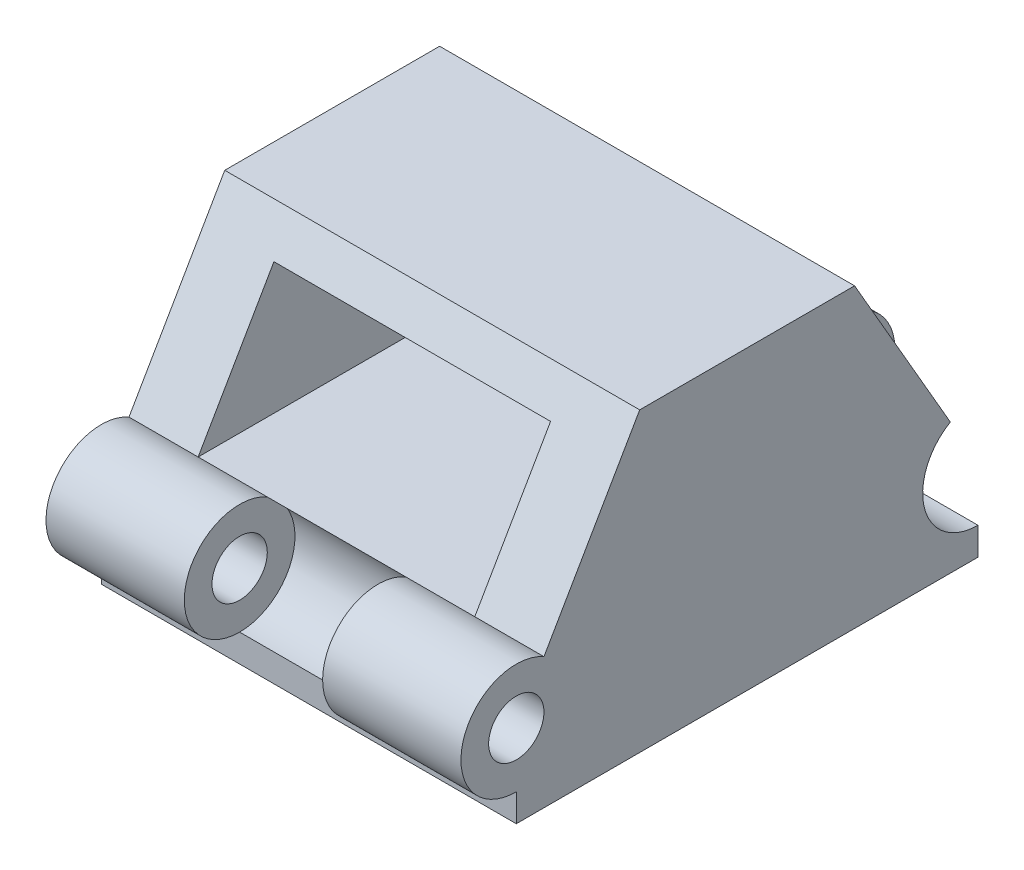
from build123d import *

# Parameters (mm, degrees)
EXTRUDE_1_DEPTH      = 30
SKETCH_2_W           = 20
SKETCH_2_H           = 10.454482672
CUT_EXTRUDE_1_DEPTH  = 52.134626233
CUT_EXTRUDE_4_DEPTH  = 52.134626233
SKETCH_4_R           = 4
SKETCH_4_R_2         = 2
EXTRUDE_2_DEPTH      = 30
CUT_EXTRUDE_5_DEPTH  = 53.403183519
SKETCH_6_R           = 4
SKETCH_6_R_2         = 2
EXTRUDE_3_DEPTH      = 30
CUT_EXTRUDE_START    = -10
SKETCH_7_R           = 4
SKETCH_7_R_2         = 2
CUT_EXTRUDE_8_DEPTH  = 10
SKETCH_8_R           = 4
SKETCH_8_R_2         = 2
CUT_EXTRUDE_9_DEPTH  = 10
CUT_EXTRUDE_START_2  = -20
SKETCH_9_R           = 4
SKETCH_9_R_2         = 2
CUT_EXTRUDE_10_DEPTH = 10
EXTRUDE_4_DEPTH      = 30
SKETCH_12_W          = 33.381197846
SKETCH_12_H          = 2
EXTRUDE_5_DEPTH      = 30
EXTRUDE_6_DEPTH      = 30
SKETCH_13_W          = 20
SKETCH_13_H          = 3.5
CUT_EXTRUDE_11_DEPTH = 30


with BuildPart() as part:
    # 스케치1 → 보스-돌출1 (new body)
    with BuildSketch(Plane(origin=(0, 0, 0), x_dir=(0, 0, -1), z_dir=(1, 0, 0))):
        Polygon((0, 0), (9.5, 16.454482672), (28.5, 16.454482672), (38, 0), align=None)
    extrude(amount=EXTRUDE_1_DEPTH)

    # 스케치2 → 컷-돌출1 (cut, through all)
    with BuildSketch(Plane.XY):
        with Locations((15, 8.227241336)):
            Rectangle(SKETCH_2_W, SKETCH_2_H)
    extrude(amount=-CUT_EXTRUDE_1_DEPTH, mode=Mode.SUBTRACT)

    # 스케치3 → 컷-돌출4 (cut, through all)
    with BuildSketch(Plane(origin=(30, 0, 0), x_dir=(0, 0, -1), z_dir=(1, 0, 0))):
        with BuildLine():
            Line((33.690598923, 7.464101615), (37.690598923, 0.535898385))
            ThreePointArc((37.690598923, 0.535898385), (39.154700538, 2), (39.690598923, 4))
            ThreePointArc((39.690598923, 4), (37.690598923, 7.464101615), (33.690598923, 7.464101615))
        make_face()
        with BuildLine():
            ThreePointArc((35.690598923, 0), (36.725875104, 0.136296695), (37.690598923, 0.535898385))
            Line((37.690598923, 0.535898385), (33.690598923, 7.464101615))
            ThreePointArc((33.690598923, 7.464101615), (31.826895618, 2.96472382), (35.690598923, 0))
        make_face()
        with BuildLine():
            Line((35.690598923, 0), (38, 0))
            Line((38, 0), (37.690598923, 0.535898385))
            ThreePointArc((37.690598923, 0.535898385), (36.725875104, 0.136296695), (35.690598923, 0))
        make_face()
    extrude(amount=-CUT_EXTRUDE_4_DEPTH, mode=Mode.SUBTRACT)

    # 스케치4 → 보스-돌출2 (add)
    with BuildSketch(Plane(origin=(30, 0, 0), x_dir=(0, 0, -1), z_dir=(1, 0, 0))):
        with Locations((35.690598923, 4)):
            Circle(SKETCH_4_R)
        with Locations((35.690598923, 4)):
            Circle(SKETCH_4_R_2, mode=Mode.SUBTRACT)
    extrude(amount=-EXTRUDE_2_DEPTH)

    # 스케치5 → 컷-돌출5 (cut, through all)
    with BuildSketch(Plane(origin=(30, 0, 0), x_dir=(0, 0, -1), z_dir=(1, 0, 0))):
        with BuildLine():
            Line((4.309401077, 7.464101615), (0.309401077, 0.535898385))
            ThreePointArc((0.309401077, 0.535898385), (1.274124896, 0.136296695), (2.309401077, 0))
            ThreePointArc((2.309401077, 0), (5.137828202, 1.171572875), (6.309401077, 4))
            ThreePointArc((6.309401077, 4), (5.773502692, 6), (4.309401077, 7.464101615))
        make_face()
        with BuildLine():
            ThreePointArc((4.309401077, 7.464101615), (-1.154700538, 6), (0.309401077, 0.535898385))
            Line((0.309401077, 0.535898385), (4.309401077, 7.464101615))
        make_face()
        with BuildLine():
            ThreePointArc((2.309401077, 0), (1.274124896, 0.136296695), (0.309401077, 0.535898385))
            Line((0.309401077, 0.535898385), (0, 0))
            Line((0, 0), (2.309401077, 0))
        make_face()
    extrude(amount=-CUT_EXTRUDE_5_DEPTH, mode=Mode.SUBTRACT)

    # 스케치6 → 보스-돌출3 (add)
    with BuildSketch(Plane(origin=(30, 0, 0), x_dir=(0, 0, -1), z_dir=(1, 0, 0))):
        with Locations((2.309401077, 4)):
            Circle(SKETCH_6_R)
        with Locations((2.309401077, 4)):
            Circle(SKETCH_6_R_2, mode=Mode.SUBTRACT)
    extrude(amount=-EXTRUDE_3_DEPTH)

    # 스케치7 → 컷-돌출8 (cut)
    with BuildSketch(Plane(origin=(30, 0, 0), x_dir=(0, 0, -1), z_dir=(1, 0, 0)).offset(CUT_EXTRUDE_START)):
        with Locations((2.309401077, 4)):
            Circle(SKETCH_7_R)
        with Locations((2.309401077, 4)):
            Circle(SKETCH_7_R_2, mode=Mode.SUBTRACT)
    extrude(amount=-CUT_EXTRUDE_8_DEPTH, mode=Mode.SUBTRACT)

    # 스케치8 → 컷-돌출9 (cut)
    with BuildSketch(Plane(origin=(30, 0, 0), x_dir=(0, 0, -1), z_dir=(1, 0, 0))):
        with Locations((35.690598923, 4)):
            Circle(SKETCH_8_R)
        with Locations((35.690598923, 4)):
            Circle(SKETCH_8_R_2, mode=Mode.SUBTRACT)
    extrude(amount=-CUT_EXTRUDE_9_DEPTH, mode=Mode.SUBTRACT)

    # 스케치9 → 컷-돌출10 (cut)
    with BuildSketch(Plane(origin=(30, 0, 0), x_dir=(0, 0, -1), z_dir=(1, 0, 0)).offset(CUT_EXTRUDE_START_2)):
        with Locations((35.690598923, 4)):
            Circle(SKETCH_9_R)
        with Locations((35.690598923, 4)):
            Circle(SKETCH_9_R_2, mode=Mode.SUBTRACT)
    extrude(amount=-CUT_EXTRUDE_10_DEPTH, mode=Mode.SUBTRACT)

    # 스케치11 → 보스-돌출4 (add)
    with BuildSketch(Plane(origin=(30, 0, 0), x_dir=(0, 0, -1), z_dir=(1, 0, 0))):
        with BuildLine():
            Line((4.309401077, 7.464101615), (33.690598923, 7.464101615))
            ThreePointArc((33.690598923, 7.464101615), (31.826895618, 2.96472382), (35.690598923, 0))
            Line((35.690598923, 0), (2.309401077, 0))
            ThreePointArc((2.309401077, 0), (6.173104382, 2.96472382), (4.309401077, 7.464101615))
        make_face()
    extrude(amount=-EXTRUDE_4_DEPTH)

    # 스케치12 → 보스-돌출5 (add)
    with BuildSketch(Plane.ZY):
        with Locations((-19, -1)):
            Rectangle(SKETCH_12_W, SKETCH_12_H)
    extrude(amount=-EXTRUDE_5_DEPTH)

    # 스케치14 → 보스-돌출6 (add)
    with BuildSketch(Plane(origin=(30, 0, 0), x_dir=(0, 0, -1), z_dir=(1, 0, 0))):
        Polygon((28.5, 16.454482672), (26.767949192, 19.454482672), (11.232050808, 19.454482672), (9.5, 16.454482672), align=None)
    extrude(amount=-EXTRUDE_6_DEPTH)

    # 스케치13 → 컷-돌출11 (cut)
    with BuildSketch(Plane(origin=(0, 0, -35.690598923), x_dir=(-1, 0, 0), z_dir=(0, 0, -1))):
        with Locations((-15, 15.204482672)):
            Rectangle(SKETCH_13_W, SKETCH_13_H)
    extrude(amount=-CUT_EXTRUDE_11_DEPTH, mode=Mode.SUBTRACT)


solid = part.part
